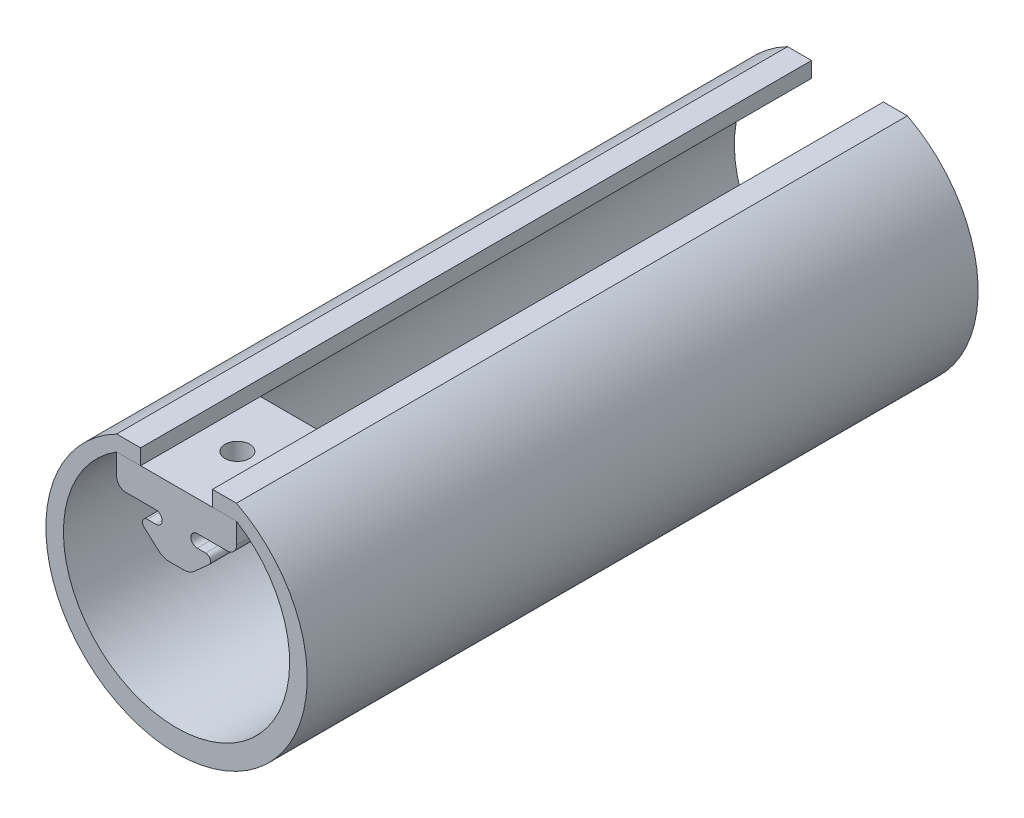
from build123d import *

# Parameters (mm, degrees)
EXTRUDE1_DEPTH      = 25
SKETCH2_R           = 2.5796875
CUT_EXTRUDE1_DEPTH  = 32.407601389
SKETCH5_W           = 5
SKETCH5_H           = 3.237358095
BOSS_EXTRUDE1_DEPTH = 140


with BuildPart() as part:
    # Sketch1 → Extrude1 (new body)
    with BuildSketch(Plane.XY):
        with BuildLine():
            Line((4.315, 12.745), (10.532068835, 12.745))
            ThreePointArc((10.532068835, 12.745), (11.926539753, 13.316381695), (12.505, 14.707931165))
            Line((12.505, 14.707931165), (12.505, 19.095))
            Line((12.505, 19.095), (-12.495, 19.095))
            Line((-12.495, 19.095), (-12.495, 14.707931165))
            ThreePointArc((-12.495, 14.707931165), (-11.920070773, 13.319929227), (-10.532068835, 12.745))
            Line((-10.532068835, 12.745), (-4.315, 12.745))
            ThreePointArc((-4.315, 12.745), (-3, 11.43), (-4.315, 10.115))
            Line((-4.315, 10.115), (-6.085, 10.115))
            ThreePointArc((-6.085, 10.115), (-7.028446777, 9.465566469), (-6.758614403, 8.352441938))
            Line((-6.758614403, 8.352441938), (-3.664622209, 5.583010835))
            ThreePointArc((-3.664622209, 5.583010835), (-2.682085626, 4.983884868), (-1.550406707, 4.775))
            Line((-1.550406707, 4.775), (1.550406707, 4.775))
            ThreePointArc((1.550406707, 4.775), (2.682085626, 4.983884868), (3.664622209, 5.583010835))
            Line((3.664622209, 5.583010835), (6.758614403, 8.352441938))
            ThreePointArc((6.758614403, 8.352441938), (7.028446777, 9.465566469), (6.085, 10.115))
            Line((6.085, 10.115), (4.315, 10.115))
            ThreePointArc((4.315, 10.115), (3, 11.43), (4.315, 12.745))
        make_face()
    extrude(amount=-EXTRUDE1_DEPTH)

    # Sketch2 → Cut-Extrude1 (cut, through all)
    with BuildSketch(Plane(origin=(0, 19.095, 0), x_dir=(1, 0, 0), z_dir=(0, 1, 0))):
        with Locations(Location((0, 12.7, 0), (0, 0, 126.94195449))):
            Circle(SKETCH2_R)
    extrude(amount=-CUT_EXTRUDE1_DEPTH, mode=Mode.SUBTRACT)


with BuildPart() as body_2:
    # Sketch5 → Boss-Extrude1 (new body)
    with BuildSketch(Plane.XY):
        with BuildLine():
            Line((-12.495, 19.095), (-12.495, 22.332358095))
            ThreePointArc((-12.495, 22.332358095), (0.005, -29.167686251), (12.505, 22.332358095))
            Line((12.505, 22.332358095), (12.505, 19.095))
            ThreePointArc((12.505, 19.095), (0.005, -24.517190702), (-12.495, 19.095))
        make_face()
        with Locations((-9.995, 20.713679048)):
            Rectangle(SKETCH5_W, SKETCH5_H)
        with Locations((10.005, 20.713679048)):
            Rectangle(SKETCH5_W, SKETCH5_H)
    extrude(amount=-BOSS_EXTRUDE1_DEPTH)


solid = Compound([part.part, body_2.part])
